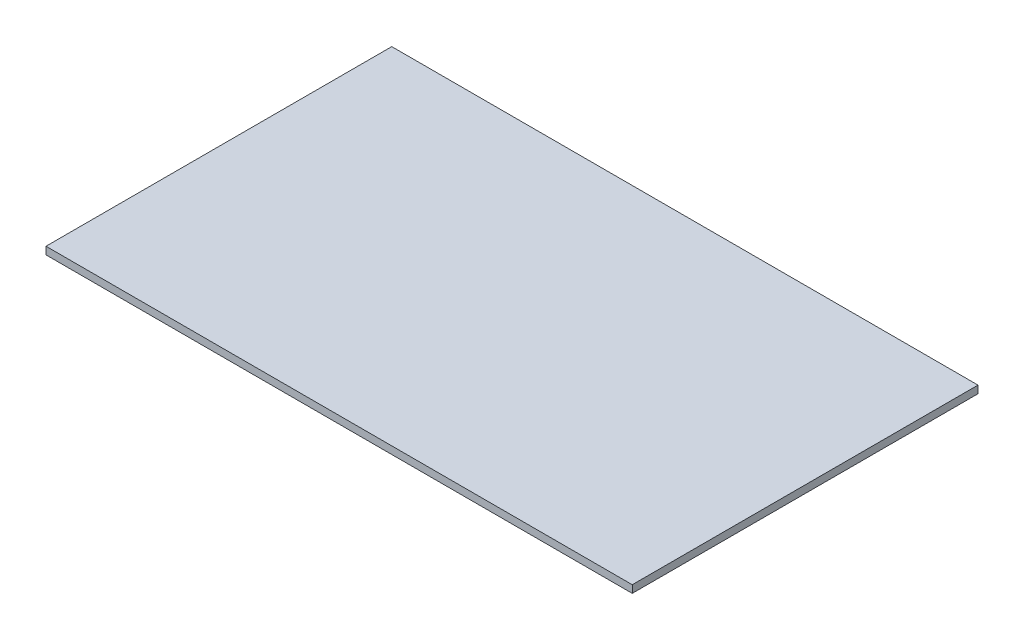
from build123d import *

# Parameters (mm, degrees)
SKETCH1_W           = 78
SKETCH1_H           = 46
BOSS_EXTRUDE1_DEPTH = 1


with BuildPart() as part:
    # Sketch1 → Boss-Extrude1 (new body)
    with BuildSketch(Plane(origin=(0, 0, 0), x_dir=(1, 0, 0), z_dir=(0, 1, 0))):
        Rectangle(SKETCH1_W, SKETCH1_H)
    extrude(amount=BOSS_EXTRUDE1_DEPTH)


solid = part.part
